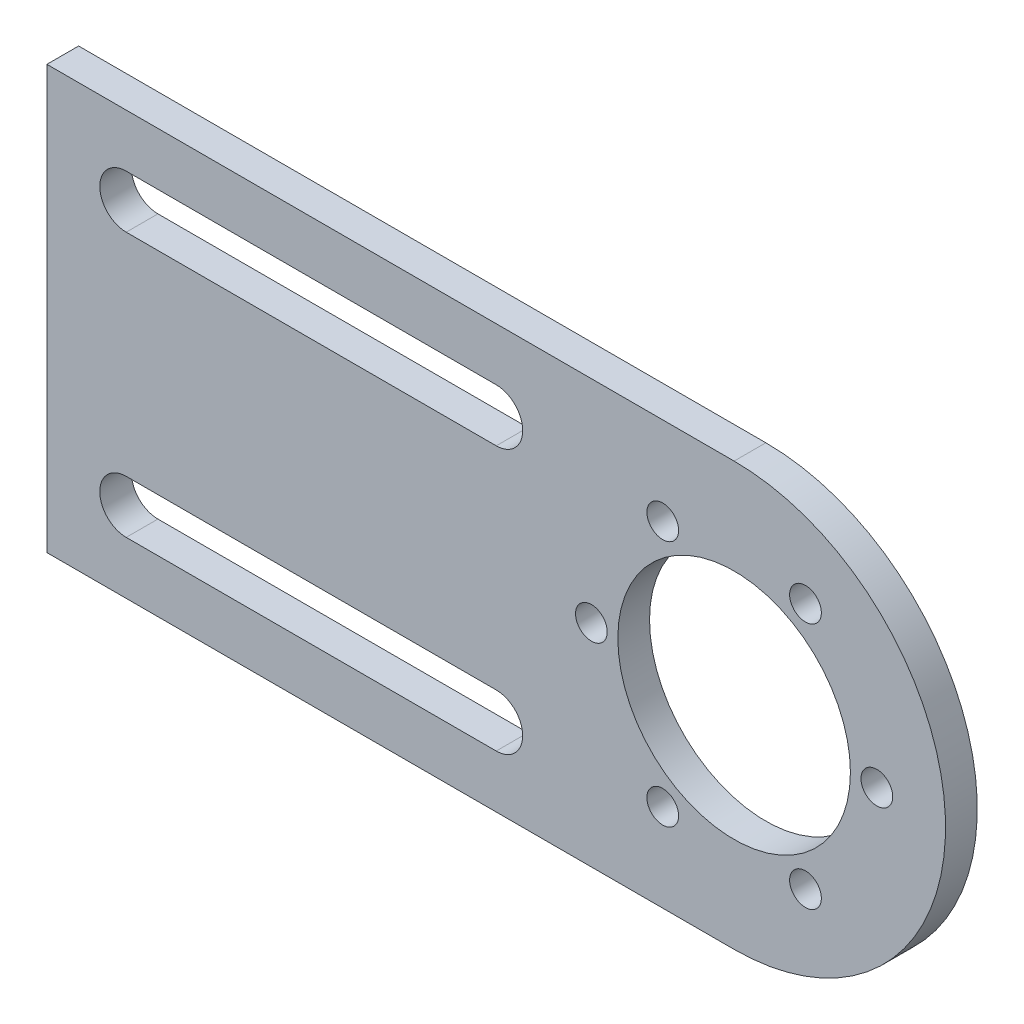
from build123d import *

# Parameters (mm, degrees)
SKETCH1_R           = 11
BOSS_EXTRUDE1_DEPTH = 3
SKETCH2_R           = 1.5
CUT_EXTRUDE1_DEPTH  = 3
CIRPATTERN1_COUNT   = 6


with BuildPart() as part:
    # Sketch1 → Boss-Extrude1 (new body)
    with BuildSketch(Plane.XY):
        with BuildLine():
            Line((32.5, 20), (-32.5, 20))
            Line((-32.5, 20), (-32.5, -20))
            Line((-32.5, -20), (32.5, -20))
            ThreePointArc((32.5, -20), (52.5, 0), (32.5, 20))
        make_face()
        with Locations((32.5, 0)):
            Circle(SKETCH1_R, mode=Mode.SUBTRACT)
        with BuildLine():
            Line((-25, 15), (10, 15))
            ThreePointArc((10, 15), (12.5, 12.5), (10, 10))
            Line((10, 10), (-25, 10))
            ThreePointArc((-25, 10), (-27.5, 12.5), (-25, 15))
        make_face(mode=Mode.SUBTRACT)
        with BuildLine():
            Line((-25, -10), (10, -10))
            ThreePointArc((10, -10), (12.5, -12.5), (10, -15))
            Line((10, -15), (-25, -15))
            ThreePointArc((-25, -15), (-27.5, -12.5), (-25, -10))
        make_face(mode=Mode.SUBTRACT)
    extrude(amount=BOSS_EXTRUDE1_DEPTH)

    # Sketch2 → Cut-Extrude1 (cut)
    with BuildSketch(Plane.XY.offset(3)):
        with Locations((46, 0)):
            Circle(SKETCH2_R)
    cut_extrude1 = extrude(amount=-CUT_EXTRUDE1_DEPTH, mode=Mode.SUBTRACT)

    # CirPattern1: Cut-Extrude1 ×6 about axis
    cirpattern1_axis = Axis((32.5, 0, 0), (0, 0, 1))
    for i in range(1, CIRPATTERN1_COUNT):
        add(cut_extrude1.rotate(cirpattern1_axis, i * 360 / CIRPATTERN1_COUNT), mode=Mode.SUBTRACT)


solid = part.part
